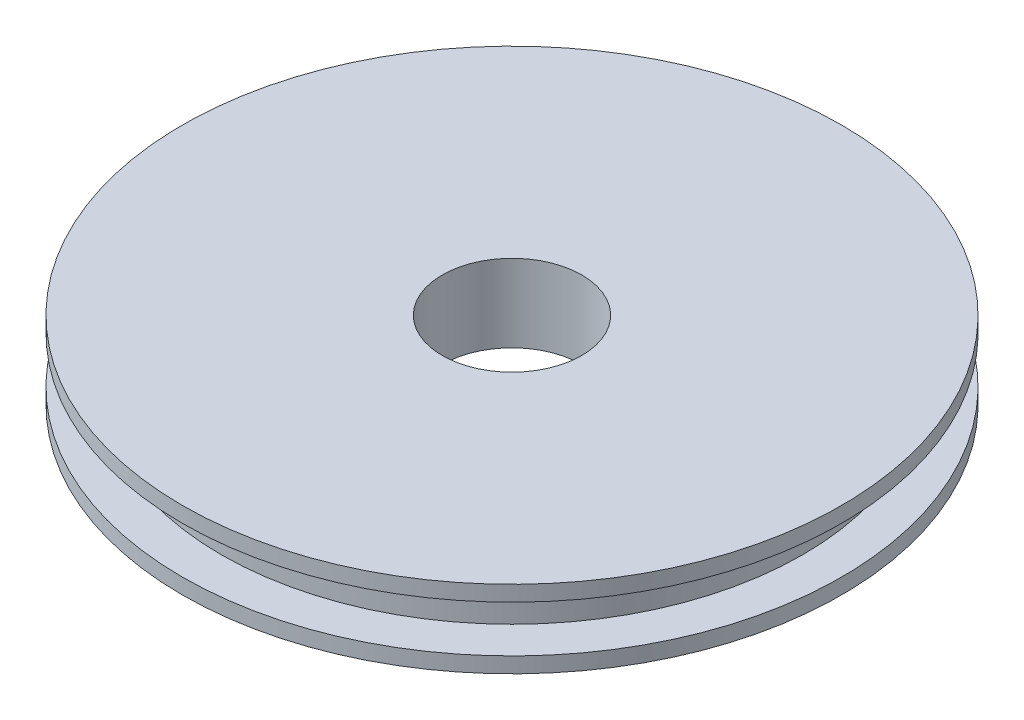
from build123d import *


with BuildPart() as part:
    # Sketch1 → Revolve1 (revolve)
    with BuildSketch(Plane.XY, mode=Mode.PRIVATE) as revolve1_sk:
        Polygon((9, 10), (42.5, 10), (42.5, 8), (37.5, 8), (37.5, 2), (42.5, 2), (42.5, 0), (9, 0), align=None)
    revolve(revolve1_sk.sketch.rotate(Axis((0, 0, 0), (0, 1, 0)), 90), axis=Axis((0, 0, 0), (0, 1, 0)))


solid = part.part
